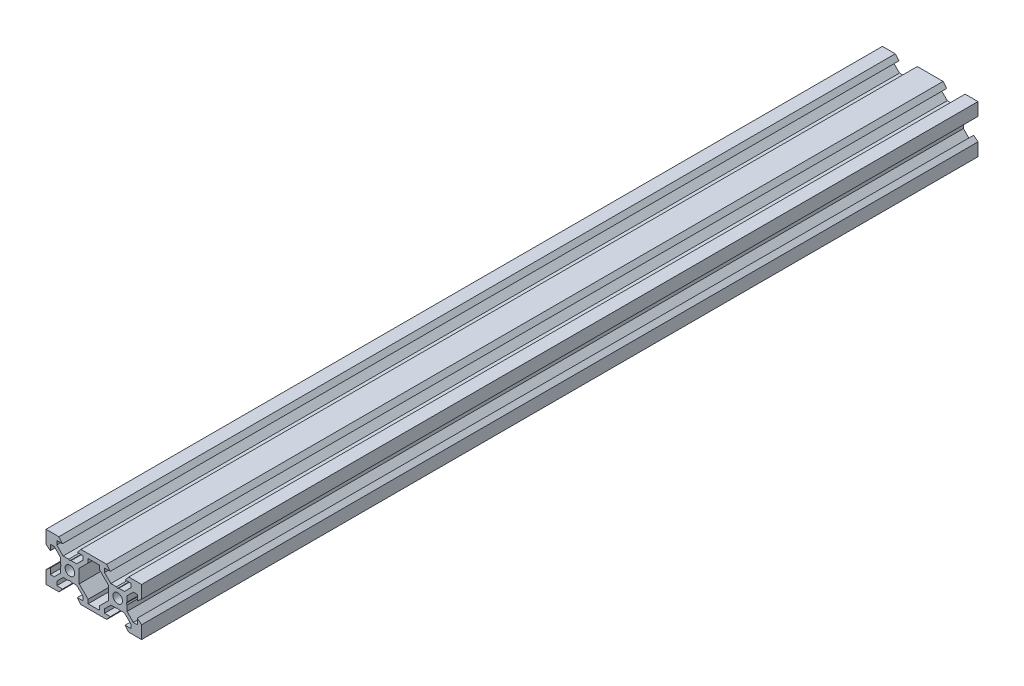
from build123d import *

# Parameters (mm, degrees)
SKETCH1_R           = 2
BOSS_EXTRUDE1_DEPTH = 350


with BuildPart() as part:
    # Sketch1 → Boss-Extrude1 (new body)
    with BuildSketch(Plane.XY):
        Polygon((-5.389620664, 10), (5.389620664, 10), (6.9, 8.2), (4.5, 8.2), (4.5, 6.556171609), (7.151917065, 3.899773171), (9.480384758, 3.899773171), (10, 3.599773171), (10.519615242, 3.899773171), (12.848082935, 3.899773171), (15.5, 6.556171609), (15.5, 8.2), (13.1, 8.2), (14.610379336, 10), (20, 10), (20, 4.610379336), (18.2, 3.1), (18.2, 5.5), (16.556171609, 5.5), (13.9, 2.839339828), (13.9, 0.519615231), (13.599999981, 0), (13.9, -0.519615231), (13.9, -2.839339828), (16.556171609, -5.5), (18.2, -5.5), (18.2, -3.1), (20, -4.610379336), (20, -10), (14.610379336, -10), (13.1, -8.2), (15.5, -8.2), (15.5, -6.556171609), (12.839339828, -3.9), (10.519222362, -3.9), (10, -3.600226829), (9.480777638, -3.9), (7.160660172, -3.9), (4.5, -6.556171609), (4.5, -8.2), (6.9, -8.2), (5.389620664, -10), (-5.389620664, -10), (-6.9, -8.2), (-4.5, -8.2), (-4.5, -6.556171609), (-7.160432959, -3.900226829), (-9.480384758, -3.900226829), (-10, -3.600226829), (-10.519615242, -3.900226829), (-12.839339828, -3.9), (-15.5, -6.556171609), (-15.5, -8.2), (-13.1, -8.2), (-14.610379336, -10), (-20, -10), (-20, -4.610379336), (-18.2, -3.1), (-18.2, -5.5), (-16.556171609, -5.5), (-13.9, -2.839339828), (-13.9, -0.519615231), (-13.599999981, 0), (-13.9, 0.519615231), (-13.9, 2.839339828), (-16.556171609, 5.5), (-18.2, 5.5), (-18.2, 3.1), (-20, 4.610379336), (-20, 10), (-14.610379336, 10), (-13.1, 8.2), (-15.5, 8.2), (-15.5, 6.556171609), (-12.839339828, 3.9), (-10.519615242, 3.899773171), (-10, 3.599773171), (-9.480384758, 3.899773171), (-7.160660172, 3.9), (-4.5, 6.556171609), (-4.5, 8.2), (-6.9, 8.2), align=None)
        with Locations((-10, 0)):
            Circle(SKETCH1_R, mode=Mode.SUBTRACT)
        with Locations((10, 0)):
            Circle(SKETCH1_R, mode=Mode.SUBTRACT)
        Polygon((-6.1, -2.839339828), (-2.376887287, -6.556171609), (-2.376887287, -8.2), (2.376887287, -8.2), (2.376887287, -6.556171609), (6.1, -2.839339828), (6.1, 2.839339828), (2.383168219, 6.556171609), (2.383168219, 8.2), (-2.383168219, 8.2), (-2.383168219, 6.556171609), (-6.1, 2.839339828), align=None, mode=Mode.SUBTRACT)
    extrude(amount=BOSS_EXTRUDE1_DEPTH)


solid = part.part
